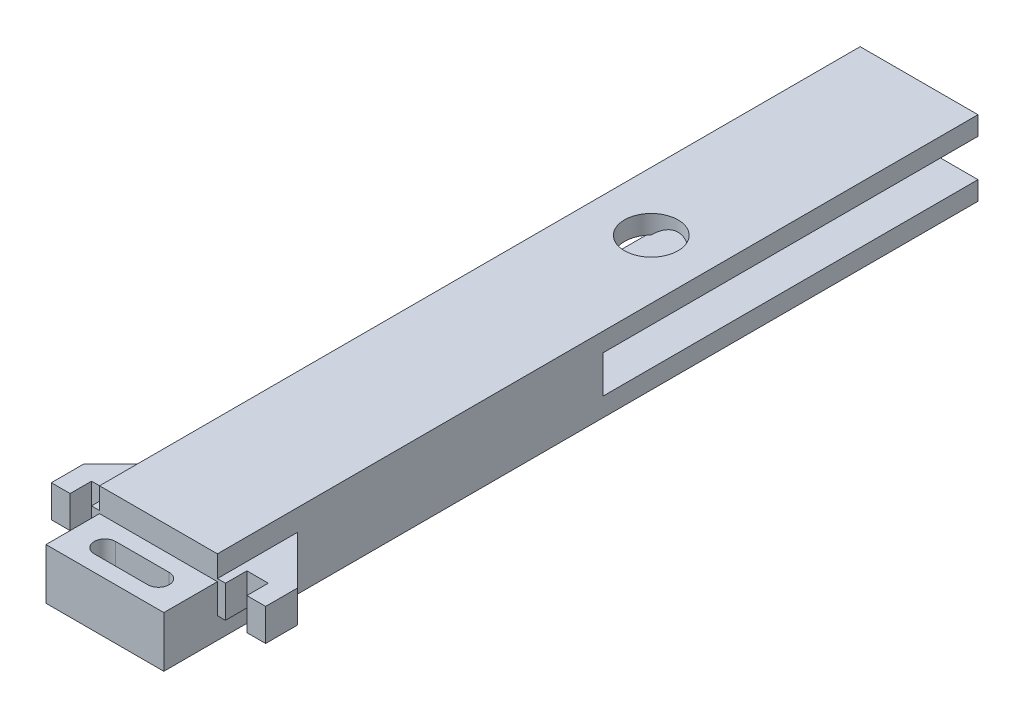
from build123d import *

# Parameters (mm, degrees)
SKETCH1_W           = 11
SKETCH1_H           = 76
BOSS_EXTRUDE1_DEPTH = 7
SKETCH4_R           = 2.5
SKETCH5_W           = 3
SKETCH5_H           = 3
BOSS_EXTRUDE2_DEPTH = 4.5
SKETCH6_W           = 2
SKETCH6_H           = 3
CUT_EXTRUDE2_DEPTH  = 2
BOSS_EXTRUDE3_DEPTH = 3
SKETCH10_W          = 11
SKETCH10_H          = 3.5
CUT_EXTRUDE5_DEPTH  = 35
CUT_EXTRUDE6_REACH  = 41.912
SKETCH11_R          = 2.5
SKETCH12_W          = 11
SKETCH12_H          = 2.25
CUT_EXTRUDE9_DEPTH  = 5
CUT_EXTRUDE10_REACH = 41.58


with BuildPart() as part:
    # Sketch1 → Boss-Extrude1 (new body)
    with BuildSketch(Plane(origin=(0, 0, 0), x_dir=(1, 0, 0), z_dir=(0, 1, 0))):
        Rectangle(SKETCH1_W, SKETCH1_H)
    extrude(amount=BOSS_EXTRUDE1_DEPTH)

    # Cut-Sweep2: sweep along a path in Sketch3
    with BuildLine(Plane.ZY) as cut_sweep2_path:
        Line((-38, 3.5), (28, 3.5))
        ThreePointArc((28, 3.5), (30.121320344, 2.621320344), (31, 0.5))
        Line((31, 0.5), (31, 0))
    # Sketch4 → Cut-Sweep2 (sweep, cut)
    with BuildSketch(Plane(origin=(0, 0, -38), x_dir=(-1, 0, 0), z_dir=(0, 0, -1))):
        with Locations((0, 3.5)):
            Circle(SKETCH4_R)
    sweep(path=cut_sweep2_path.line, mode=Mode.SUBTRACT)

    # Sketch5 → Boss-Extrude2 (add)
    with BuildSketch(Plane.ZY.offset(5.5)):
        with Locations((31.5, 3.5)):
            Rectangle(SKETCH5_W, SKETCH5_H)
    boss_extrude2 = extrude(amount=BOSS_EXTRUDE2_DEPTH)

    # Mirror1: Boss-Extrude2 across plane
    add(boss_extrude2.mirror(Plane.ZY))

    # Sketch6 → Cut-Extrude2 (cut)
    with BuildSketch(Plane.XY.offset(33)):
        with Locations((-7.25, 3.5)):
            Rectangle(SKETCH6_W, SKETCH6_H)
    cut_extrude2 = extrude(amount=-CUT_EXTRUDE2_DEPTH, mode=Mode.SUBTRACT)

    # Mirror2: Cut-Extrude2 across plane
    add(cut_extrude2.mirror(Plane.ZY), mode=Mode.SUBTRACT)

    # Sketch7 → Boss-Extrude3 (add)
    with BuildSketch(Plane(origin=(0, 5, 0), x_dir=(1, 0, 0), z_dir=(0, 1, 0))):
        Polygon((-10, -30), (-5.5, -25.5), (-5.5, -30), align=None)
    boss_extrude3 = extrude(amount=-BOSS_EXTRUDE3_DEPTH)

    # Mirror3: Boss-Extrude3 across plane
    add(boss_extrude3.mirror(Plane.ZY))

    # Sketch10 → Cut-Extrude5 (cut)
    with BuildSketch(Plane(origin=(0, 0, -38), x_dir=(-1, 0, 0), z_dir=(0, 0, -1))):
        with Locations((0, 3.5)):
            Rectangle(SKETCH10_W, SKETCH10_H)
    extrude(amount=-CUT_EXTRUDE5_DEPTH, mode=Mode.SUBTRACT)

    # Sketch11 → Cut-Extrude6 (cut, up to next)
    with BuildSketch(Plane(origin=(0, 7, 0), x_dir=(1, 0, 0), z_dir=(0, 1, 0)), mode=Mode.PRIVATE) as cut_extrude6_sk1:
        with Locations(Location((0, 13, 0), (0, 0, 270))):
            Circle(SKETCH11_R)
    cut_extrude6_tool1 = extrude(cut_extrude6_sk1.sketch, amount=-CUT_EXTRUDE6_REACH, mode=Mode.PRIVATE) & part.part
    add(cut_extrude6_tool1.solids().sort_by_distance((0, 7, -13))[0], mode=Mode.SUBTRACT)

    # Sketch12 → Cut-Extrude9 (cut)
    with BuildSketch(Plane.XY.offset(38)):
        with Locations((0, 5.875)):
            Rectangle(SKETCH12_W, SKETCH12_H)
    extrude(amount=-CUT_EXTRUDE9_DEPTH, mode=Mode.SUBTRACT)

    # Sketch14 → Cut-Extrude10 (cut, up to next)
    with BuildSketch(Plane(origin=(0, 4.75, 0), x_dir=(1, 0, 0), z_dir=(0, 1, 0)), mode=Mode.PRIVATE) as cut_extrude10_sk1:
        with BuildLine():
            Line((-2.5, -34.5), (2.5, -34.5))
            ThreePointArc((2.5, -34.5), (3.5, -35.5), (2.5, -36.5))
            Line((2.5, -36.5), (-2.5, -36.5))
            ThreePointArc((-2.5, -36.5), (-3.5, -35.5), (-2.5, -34.5))
        make_face()
    cut_extrude10_tool1 = extrude(cut_extrude10_sk1.sketch, amount=-CUT_EXTRUDE10_REACH, mode=Mode.PRIVATE) & part.part
    add(cut_extrude10_tool1.solids().sort_by_distance((0, 4.75, 35.5))[0], mode=Mode.SUBTRACT)


solid = part.part
